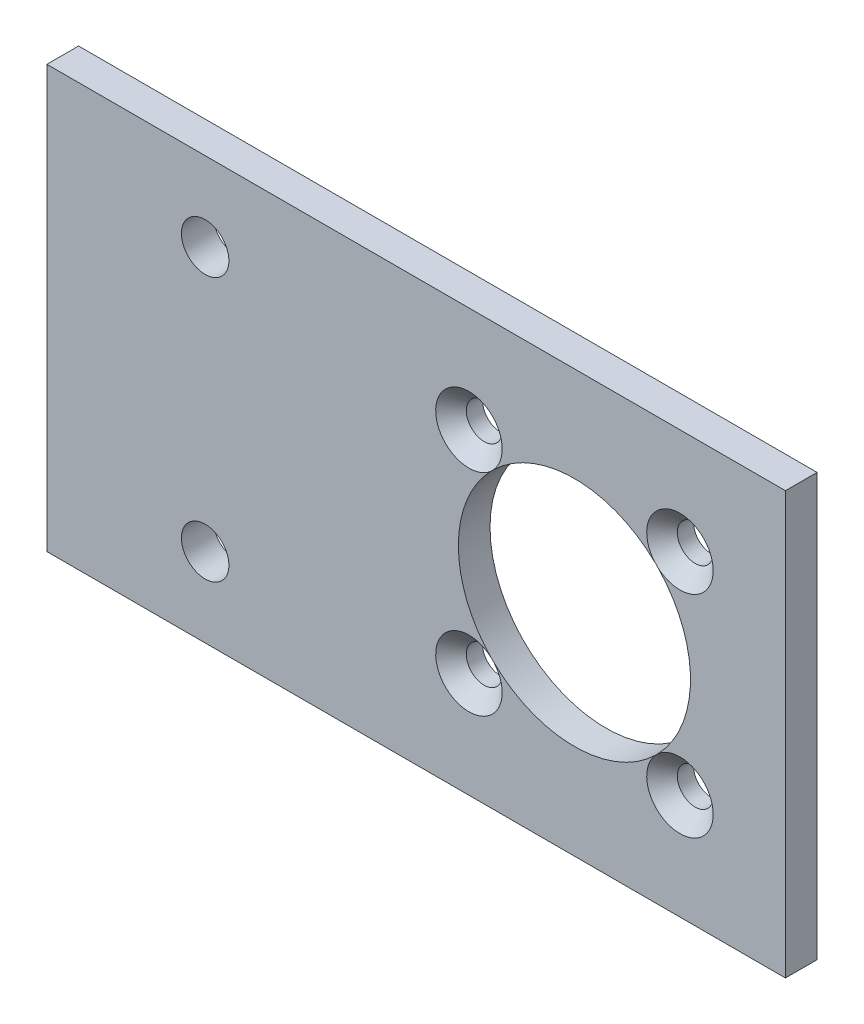
from build123d import *

# Parameters (mm, degrees)
SKIZZE1_W                                    = 70
SKIZZE1_H                                    = 40
AUFSATZ_LINEAR_AUSTRAGEN1_DEPTH              = 3
FORMSENKUNG_F_R_M3_LINSENSENKSCHRAUB_2_COUNT = 2
FORMSENKUNG_F_R_M3_LINSENSENKSCHRAUB_2_PITCH = 20
FORMSENKUNG_F_R_M3_LINSENSENKSCHRAUB_3_COUNT = 2
FORMSENKUNG_F_R_M3_LINSENSENKSCHRAUB_3_PITCH = 28.284271247
FORMSENKUNG_F_R_M3_LINSENSENKSCHRAUB_4_COUNT = 2
FORMSENKUNG_F_R_M3_LINSENSENKSCHRAUB_4_PITCH = 20
DURCHGANGSLOCH_F_R_M41_D                     = 4.5
F_22_0_22_DURCHMESSER_BOHRUNG1_D             = 22


with BuildPart() as part:
    # Skizze1 → Aufsatz-Linear austragen1 (new body)
    with BuildSketch(Plane.XY):
        with Locations((19.450005134, 330)):
            Rectangle(SKIZZE1_W, SKIZZE1_H)
    extrude(amount=AUFSATZ_LINEAR_AUSTRAGEN1_DEPTH)

    # Skizze3 → Formsenkung für M3 Linsensenkschraube mit Schlitz6 (revolve, cut)
    with BuildSketch(Plane(origin=(24.450005134, 340, 3), x_dir=(0, -1, 0), z_dir=(1, 0, 0))):
        Polygon((0, 0), (0, 3), (1.7, 3), (1.7, 1.45), (3.15, 0), align=None)
    formsenkung_f_r_m3_linsensenkschraube_mi = revolve(axis=Axis((24.450005134, 340, 9.35), (0, 0, -1)), mode=Mode.SUBTRACT)

    # Formsenkung f_r M3 Linsensenkschraub 2: Formsenkung für M3 Linsensenkschraube mit Schlitz6 ×2
    with Locations(*[(i * FORMSENKUNG_F_R_M3_LINSENSENKSCHRAUB_2_PITCH, 0, 0) for i in range(1, FORMSENKUNG_F_R_M3_LINSENSENKSCHRAUB_2_COUNT)]):
        add(formsenkung_f_r_m3_linsensenkschraube_mi, mode=Mode.SUBTRACT)

    # Formsenkung f_r M3 Linsensenkschraub 3: Formsenkung für M3 Linsensenkschraube mit Schlitz6 ×2
    with Locations(*[Vector(0.7071067811865485, -0.7071067811865466, 0) * (i * FORMSENKUNG_F_R_M3_LINSENSENKSCHRAUB_3_PITCH) for i in range(1, FORMSENKUNG_F_R_M3_LINSENSENKSCHRAUB_3_COUNT)]):
        add(formsenkung_f_r_m3_linsensenkschraube_mi, mode=Mode.SUBTRACT)

    # Formsenkung f_r M3 Linsensenkschraub 4: Formsenkung für M3 Linsensenkschraube mit Schlitz6 ×2
    with Locations(*[(0, -i * FORMSENKUNG_F_R_M3_LINSENSENKSCHRAUB_4_PITCH, 0) for i in range(1, FORMSENKUNG_F_R_M3_LINSENSENKSCHRAUB_4_COUNT)]):
        add(formsenkung_f_r_m3_linsensenkschraube_mi, mode=Mode.SUBTRACT)

    # Durchgangsloch für M41 (through all)
    with Locations(Plane.XY.offset(3)):
        with Locations((-0.549994866, 342.5), (-0.549994866, 317.5)):
            Hole(DURCHGANGSLOCH_F_R_M41_D / 2)

    # Ø22.0 (22) Durchmesser Bohrung1 (through all)
    with Locations(Plane(origin=(0, 0, 0), x_dir=(-1, 0, 0), z_dir=(0, 0, -1))):
        with Locations((-34.450005134, 330)):
            Hole(F_22_0_22_DURCHMESSER_BOHRUNG1_D / 2)


solid = part.part
